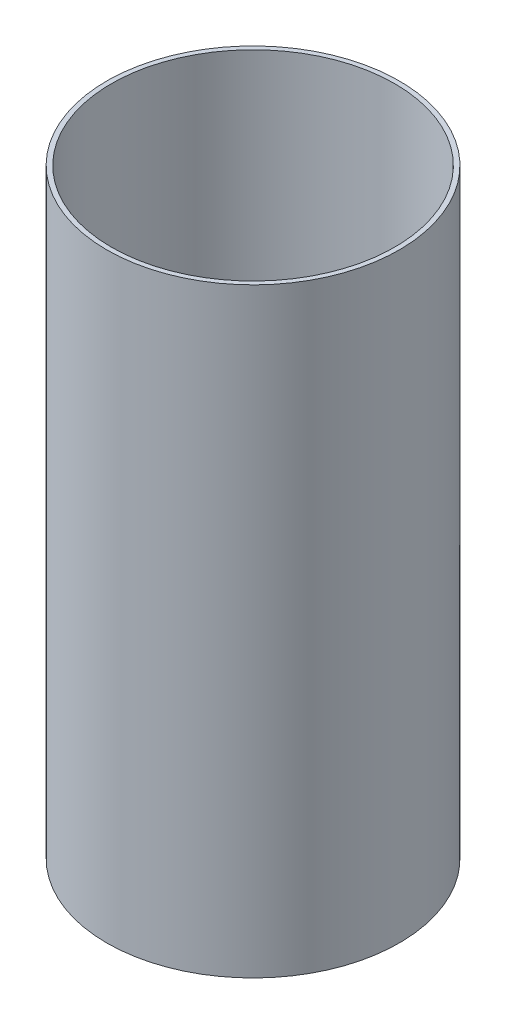
from build123d import *

# Parameters (mm, degrees)
SKETCH1_R           = 49.53
SKETCH1_R_2         = 47.9552
BOSS_EXTRUDE1_DEPTH = 203.2


with BuildPart() as part:
    # Sketch1 → Boss-Extrude1 (new body)
    with BuildSketch(Plane(origin=(0, 0, 0), x_dir=(1, 0, 0), z_dir=(0, 1, 0))):
        with Locations(Location((0, 0, 0), (0, 0, 270))):
            Circle(SKETCH1_R)
        with Locations(Location((0, 0, 0), (0, 0, 270))):
            Circle(SKETCH1_R_2, mode=Mode.SUBTRACT)
    extrude(amount=BOSS_EXTRUDE1_DEPTH)


solid = part.part
